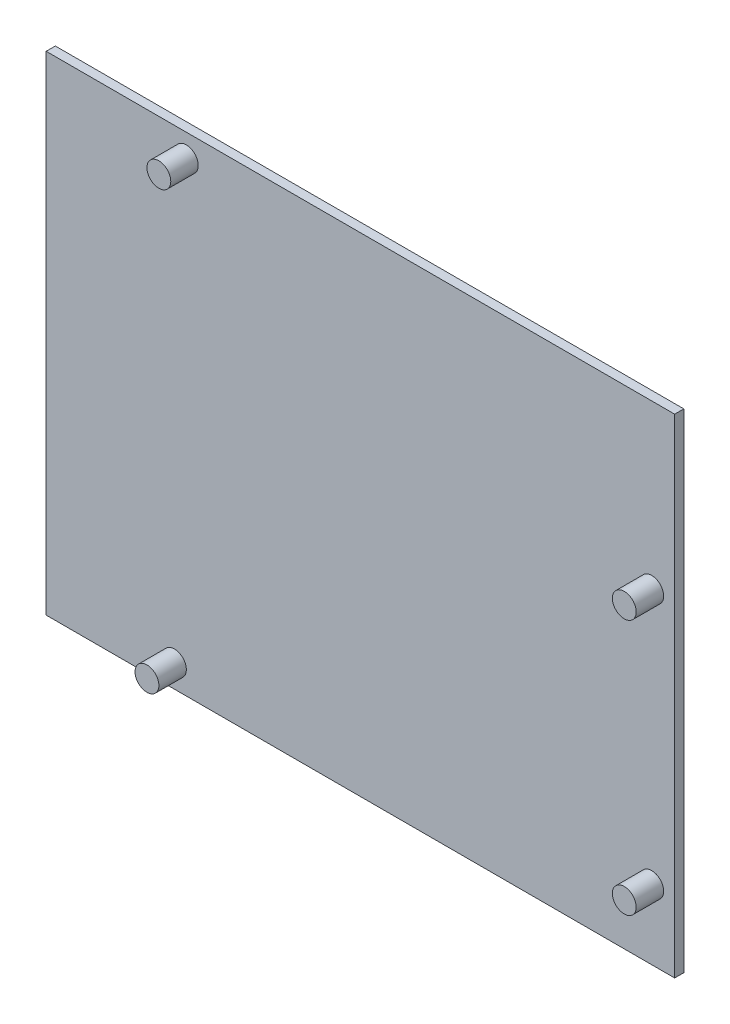
from build123d import *

# Parameters (mm, degrees)
SKETCH1_W           = 68.6
SKETCH1_H           = 53.3
BOSS_EXTRUDE1_DEPTH = 1
SKETCH2_R           = 1.3
BOSS_EXTRUDE4_DEPTH = 3


with BuildPart() as part:
    # Sketch1 → Boss-Extrude1 (new body)
    with BuildSketch(Plane.XY):
        with Locations((34.3, 26.65)):
            Rectangle(SKETCH1_W, SKETCH1_H)
    extrude(amount=BOSS_EXTRUDE1_DEPTH)

    # Sketch2 → Boss-Extrude4 (add)
    with BuildSketch(Plane.XY.offset(1)):
        with Locations(Location((14, 2.5, 0), (0, 0, 180))):
            Circle(SKETCH2_R)
        with Locations(Location((15.3, 50.8, 0), (0, 0, 180))):
            Circle(SKETCH2_R)
        with Locations(Location((66.1, 7.6, 0), (0, 0, 180))):
            Circle(SKETCH2_R)
        with Locations(Location((66.1, 35.5, 0), (0, 0, 180))):
            Circle(SKETCH2_R)
    extrude(amount=BOSS_EXTRUDE4_DEPTH)


solid = part.part
